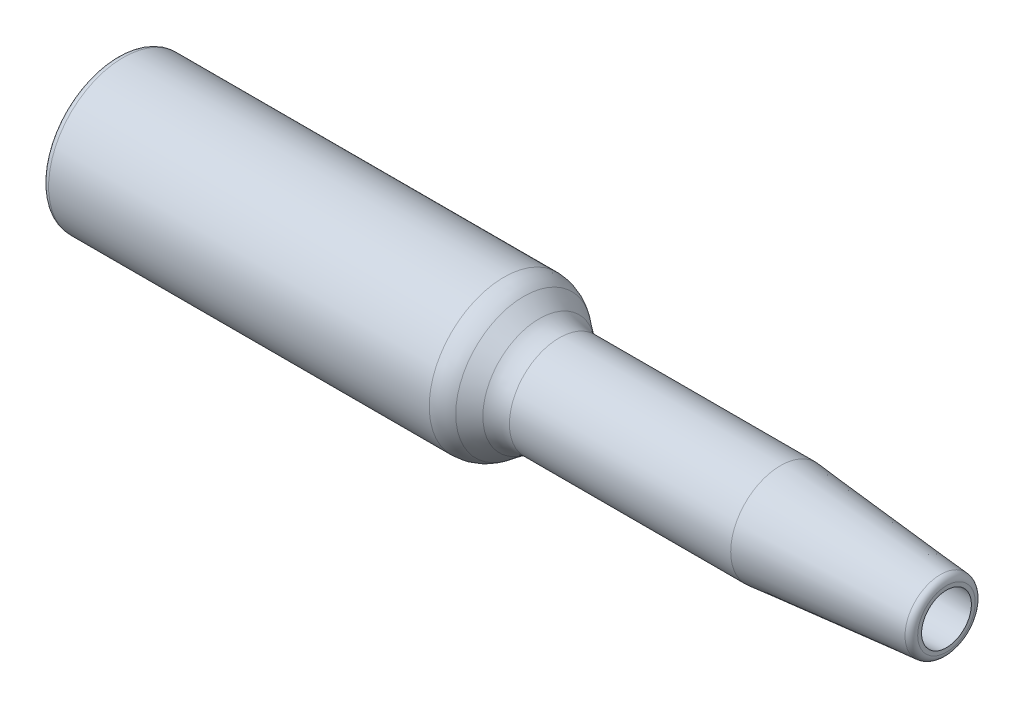
from build123d import *

# Parameters (mm, degrees)
FILLET_4_R = 0.2
FILLET_5_R = 1


with BuildPart() as part:
    # Эскиз1 → Повернуть1 (revolve)
    with BuildSketch(Plane.XY, mode=Mode.PRIVATE) as revolve_1_sk:
        Polygon((-22.392450879, 1.834990157), (-22.392450879, 2.25), (-10.392450879, 2.25), (-9.392450879, 1.5), (-2.392450879, 1.5), (2.607549121, 1.05), (2.607549121, 0.75), (-2.663312046, 1.1), (-9.392450879, 1.1), (-10.602717789, 1.834990157), align=None)
    revolve(revolve_1_sk.sketch.rotate(Axis((-52.441675284, 0, 0), (1, 0, 0)), 90), axis=Axis((-52.441675284, 0, 0), (1, 0, 0)))

    # Скругление4
    fillet_4_edges = [part.edges().sort_by_distance(p)[0] for p in [
        (-22.392450879, 0, -2.25),
        (2.607549121, 0, -1.05),
    ]]
    fillet(fillet_4_edges, radius=FILLET_4_R)

    # Скругление5
    fillet_5_edges = [part.edges().sort_by_distance(p)[0] for p in [
        (-10.392450879, 0, -2.25),
        (-9.392450879, 0, -1.5),
    ]]
    fillet(fillet_5_edges, radius=FILLET_5_R)


solid = part.part
